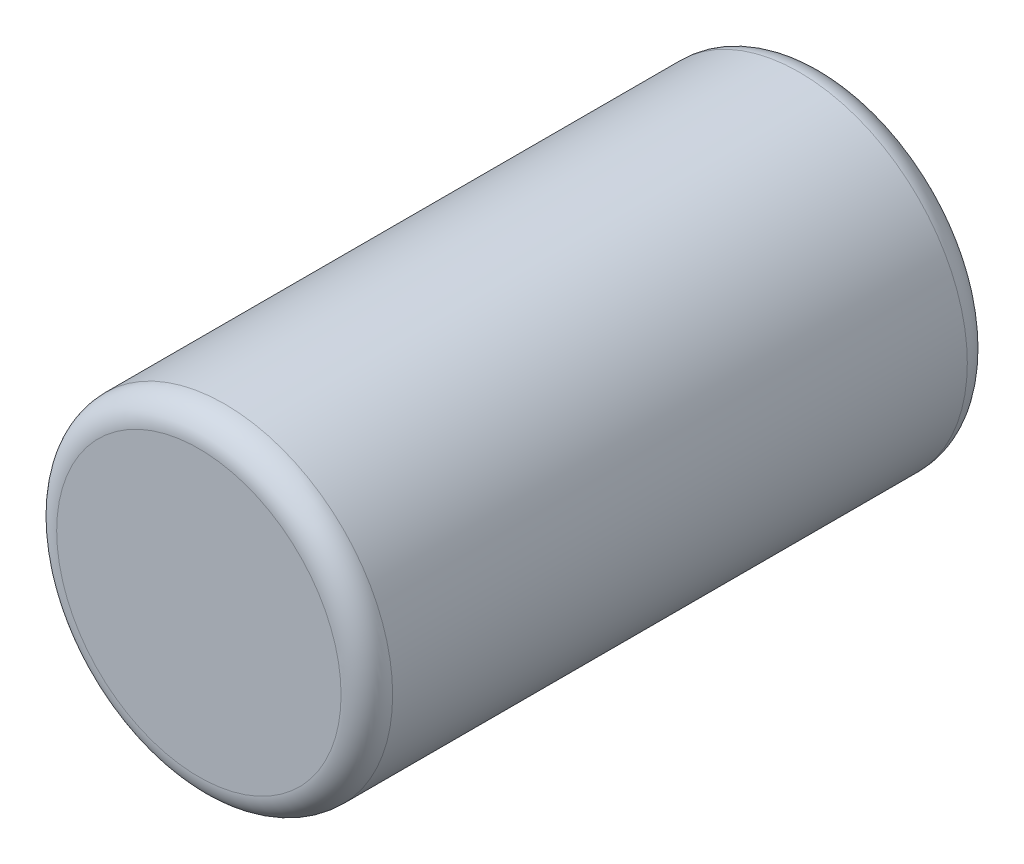
from build123d import *


with BuildPart() as part:
    # Sketch1 → Revolve1 (revolve)
    with BuildSketch(Plane(origin=(0, 0, 0), x_dir=(0, 0, -1), z_dir=(1, 0, 0)), mode=Mode.PRIVATE) as revolve1_sk:
        with BuildLine():
            Line((0, 0), (42.5, 0))
            Line((42.5, 0), (42.5, 9.65))
            ThreePointArc((42.5, 9.65), (41.987436867, 10.887436867), (40.75, 11.4))
            Line((40.75, 11.4), (1.75, 11.4))
            ThreePointArc((1.75, 11.4), (0.512563133, 10.887436867), (0, 9.65))
            Line((0, 9.65), (0, 0))
        make_face()
    revolve(revolve1_sk.sketch.rotate(Axis((0, 0, 0), (0, 0, -1)), 90), axis=Axis((0, 0, 0), (0, 0, -1)))


solid = part.part
